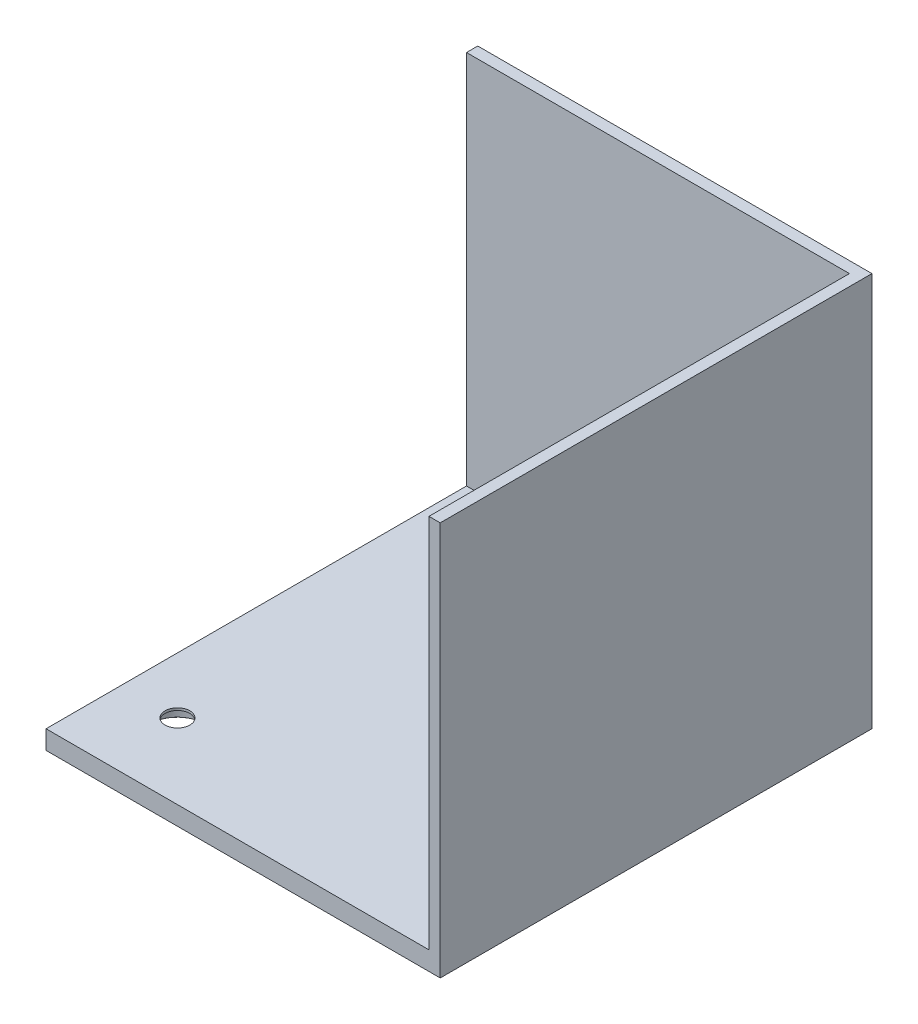
from build123d import *

# Parameters (mm, degrees)
SKETCH3_W                              = 105
SKETCH3_H                              = 115
BOSS_EXTRUDE1_DEPTH                    = 105
SKETCH6_W                              = 102
SKETCH6_H                              = 112
CUT_EXTRUDE1_DEPTH                     = 100
CBORE_FOR_M6_HEX_HEAD_BOLT1_AT_2_COUNT = 2
CBORE_FOR_M6_HEX_HEAD_BOLT1_AT_2_PITCH = 75
CBORE_FOR_M6_HEX_HEAD_BOLT1_AT_3_COUNT = 2
CBORE_FOR_M6_HEX_HEAD_BOLT1_AT_3_PITCH = 106.066017178
CBORE_FOR_M6_HEX_HEAD_BOLT1_AT_4_COUNT = 2
CBORE_FOR_M6_HEX_HEAD_BOLT1_AT_4_PITCH = 75


with BuildPart() as part:
    # Sketch3 → Boss-Extrude1 (new body)
    with BuildSketch(Plane(origin=(0, 0, 0), x_dir=(1, 0, 0), z_dir=(0, 1, 0))):
        Rectangle(SKETCH3_W, SKETCH3_H)
    extrude(amount=BOSS_EXTRUDE1_DEPTH)

    # Sketch6 → Cut-Extrude1 (cut)
    with BuildSketch(Plane(origin=(0, 105, 0), x_dir=(1, 0, 0), z_dir=(0, 1, 0))):
        with Locations((-1.5, -1.5)):
            Rectangle(SKETCH6_W, SKETCH6_H)
    extrude(amount=-CUT_EXTRUDE1_DEPTH, mode=Mode.SUBTRACT)

    # Sketch7 → CBORE for M6 Hex Head Bolt1 (revolve, cut)
    with BuildSketch(Plane(origin=(37.5, 0, 37.5), x_dir=(0, 0, -1), z_dir=(1, 0, 0))):
        Polygon((0, 0), (0, 105), (3.3, 105), (3.3, 4.38), (7.275, 4.38), (7.275, 0.025), (7.3, 0), align=None)
    cbore_for_m6_hex_head_bolt1 = revolve(axis=Axis((37.5, -6.35, 37.5), (0, 1, 0)), mode=Mode.SUBTRACT)

    # CBORE for M6 Hex Head Bolt1 at 2: CBORE for M6 Hex Head Bolt1 ×2
    with Locations(*[(0, 0, -i * CBORE_FOR_M6_HEX_HEAD_BOLT1_AT_2_PITCH) for i in range(1, CBORE_FOR_M6_HEX_HEAD_BOLT1_AT_2_COUNT)]):
        add(cbore_for_m6_hex_head_bolt1, mode=Mode.SUBTRACT)

    # CBORE for M6 Hex Head Bolt1 at 3: CBORE for M6 Hex Head Bolt1 ×2
    with Locations(*[Vector(-0.7071067811865476, 0, -0.7071067811865476) * (i * CBORE_FOR_M6_HEX_HEAD_BOLT1_AT_3_PITCH) for i in range(1, CBORE_FOR_M6_HEX_HEAD_BOLT1_AT_3_COUNT)]):
        add(cbore_for_m6_hex_head_bolt1, mode=Mode.SUBTRACT)

    # CBORE for M6 Hex Head Bolt1 at 4: CBORE for M6 Hex Head Bolt1 ×2
    with Locations(*[(-i * CBORE_FOR_M6_HEX_HEAD_BOLT1_AT_4_PITCH, 0, 0) for i in range(1, CBORE_FOR_M6_HEX_HEAD_BOLT1_AT_4_COUNT)]):
        add(cbore_for_m6_hex_head_bolt1, mode=Mode.SUBTRACT)


solid = part.part
